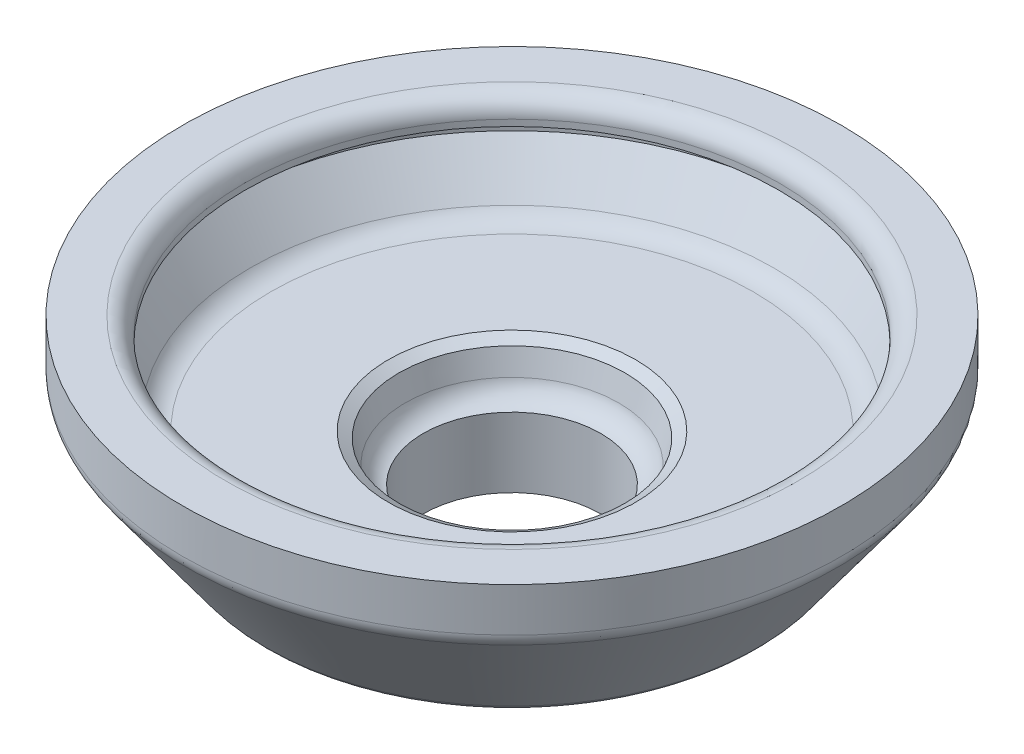
from build123d import *

# Parameters (mm, degrees)
FILLET1_R      = 0.75
FILLET2_R      = 0.75
FILLET3_R      = 1
CHAMFER1_SIZE  = 0.25
CHAMFER1_SIZE2 = 0.353553448
FILLET4_R      = 0.21


with BuildPart() as part:
    # Sketch1 → Revolve1 (revolve)
    with BuildSketch(Plane.XY, mode=Mode.PRIVATE) as revolve1_sk:
        with BuildLine():
            Line((-4.525582419, 11.152102105), (-4.217986966, 10.004140678))
            ThreePointArc((-4.217986966, 10.004140678), (-3.956016067, 9.56254519), (-3.502519935, 9.321761913))
            Line((-3.502519935, 9.321761913), (-3.502519935, 6.571761913))
            Line((-3.502519935, 6.571761913), (-4.502519935, 6.571761913))
            Line((-4.502519935, 6.571761913), (-4.502519935, 8.321761913))
            Line((-4.502519935, 8.321761913), (-9.502519935, 8.321761913))
            Line((-9.502519935, 8.321761913), (-13, 13.123852955))
            Line((-13, 13.123852955), (-13, 15.095149634))
            Line((-13, 15.095149634), (-10.55, 15.095149634))
            Line((-10.55, 15.095149634), (-10.55, 14.095149634))
            Line((-10.55, 14.095149634), (-11.55, 14.095149634))
            Line((-11.55, 14.095149634), (-11.55, 13.245149634))
            Line((-11.55, 13.245149634), (-10.025582419, 11.152102105))
            Line((-10.025582419, 11.152102105), (-4.525582419, 11.152102105))
        make_face()
    revolve(revolve1_sk.sketch.rotate(Axis((-0.002519935, 0, 0), (0, 1, 0)), 270), axis=Axis((-0.002519935, 0, 0), (0, 1, 0)))

    # Fillet1
    fillet1_edges = [part.edges().sort_by_distance(p)[0] for p in [
        (-0.002519935, 8.321761913, 4.5),
        (-0.002519935, 8.321761913, 9.5),
        (-0.002519935, 13.123852955, 12.997480065),
    ]]
    fillet(fillet1_edges, radius=FILLET1_R)

    # Fillet2
    fillet2_edges = [part.edges().sort_by_distance(p)[0] for p in [
        (-0.002519935, 15.095149634, 10.547480065),
    ]]
    fillet(fillet2_edges, radius=FILLET2_R)

    # Fillet3
    fillet3_edges = [part.edges().sort_by_distance(p)[0] for p in [
        (-0.002519935, 11.152102105, 10.023062484),
    ]]
    fillet(fillet3_edges, radius=FILLET3_R)

    # Chamfer1
    chamfer1_edges = [part.edges().sort_by_distance(p)[0] for p in [
        (-0.002519935, 11.152102105, 4.523062484),
    ]]
    chamfer1_side = [part.faces().sort_by_distance(p)[0] for p in [
        (-0.002519935, 10.578121392, 4.369264758),
    ]]
    chamfer(chamfer1_edges, length=CHAMFER1_SIZE, length2=CHAMFER1_SIZE2, reference=chamfer1_side[0])

    # Fillet4
    fillet4_edges = [part.edges().sort_by_distance(p)[0] for p in [
        (-0.002519935, 6.571761913, 4.5),
    ]]
    fillet(fillet4_edges, radius=FILLET4_R)


solid = part.part
